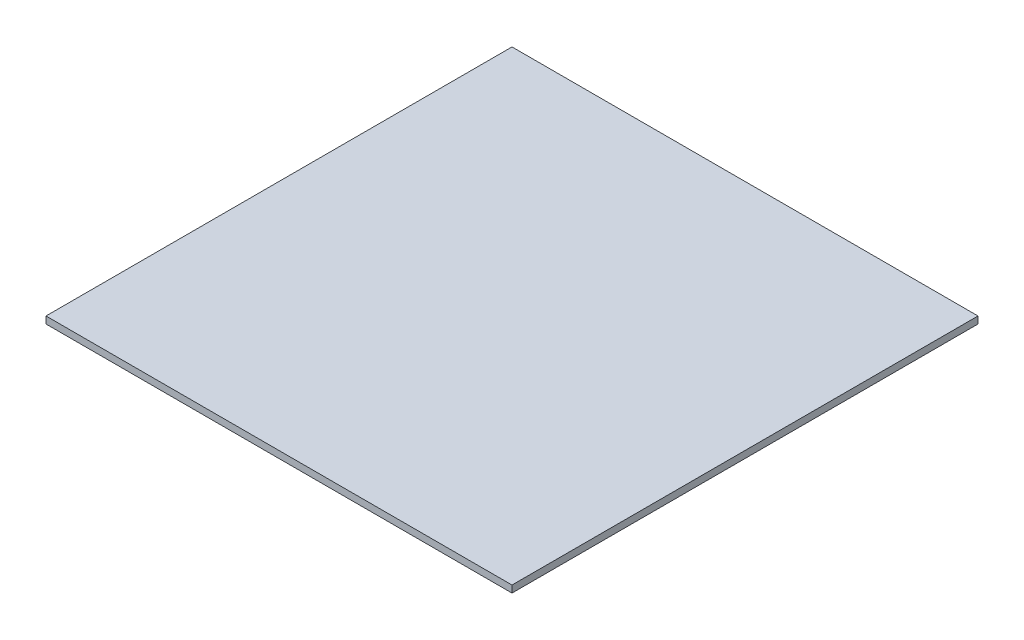
from build123d import *

# Parameters (mm, degrees)
ESBO_O1_W                = 4000
ESBO_O1_H                = 4000
RESSALTO_EXTRUS_O1_DEPTH = 60


with BuildPart() as part:
    # Esboço1 → Ressalto-extrusão1 (new body)
    with BuildSketch(Plane(origin=(0, 0, 0), x_dir=(1, 0, 0), z_dir=(0, 1, 0))):
        Rectangle(ESBO_O1_W, ESBO_O1_H)
    extrude(amount=RESSALTO_EXTRUS_O1_DEPTH)


solid = part.part
